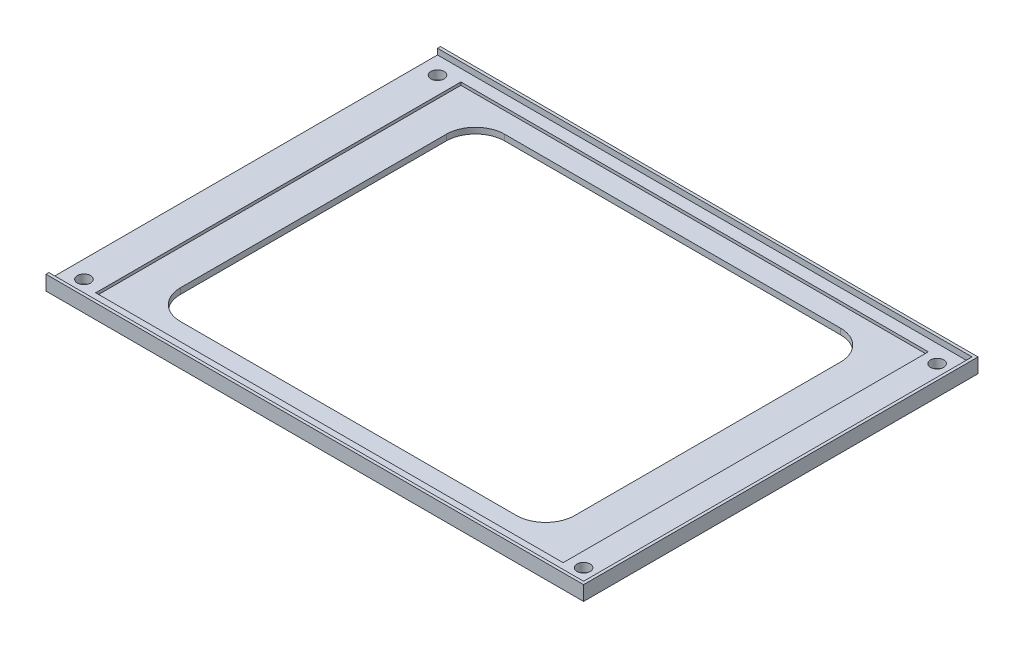
from build123d import *

# Parameters (mm, degrees)
SKETCH2_W           = 184
SKETCH2_H           = 135
BOSS_EXTRUDE1_DEPTH = 2
SKETCH3_W           = 184
SKETCH3_H           = 135
SKETCH3_W_2         = 160
SKETCH3_H_2         = 125
BOSS_EXTRUDE2_DEPTH = 1
BOSS_EXTRUDE3_DEPTH = 2
CUT_EXTRUDE1_REACH  = 170.88
SKETCH5_R           = 2.25


with BuildPart() as part:
    # Sketch2 → Boss-Extrude1 (new body)
    with BuildSketch(Plane(origin=(0, 0, 0), x_dir=(1, 0, 0), z_dir=(0, 1, 0))):
        with Locations((62.722752399, 0)):
            Rectangle(SKETCH2_W, SKETCH2_H)
        with BuildLine():
            Line((4.722752399, 55.5), (119.722752399, 55.5))
            ThreePointArc((119.722752399, 55.5), (126.79382021, 52.571067812), (129.722752399, 45.5))
            Line((129.722752399, 45.5), (129.722752399, -45.5))
            ThreePointArc((129.722752399, -45.5), (126.79382021, -52.571067812), (119.722752399, -55.5))
            Line((119.722752399, -55.5), (4.722752399, -55.5))
            ThreePointArc((4.722752399, -55.5), (-2.348315413, -52.571067812), (-5.277247601, -45.5))
            Line((-5.277247601, -45.5), (-5.277247601, 45.5))
            ThreePointArc((-5.277247601, 45.5), (-2.348315413, 52.571067812), (4.722752399, 55.5))
        make_face(mode=Mode.SUBTRACT)
    extrude(amount=BOSS_EXTRUDE1_DEPTH)

    # Sketch3 → Boss-Extrude2 (add)
    with BuildSketch(Plane(origin=(0, 2, 0), x_dir=(1, 0, 0), z_dir=(0, 1, 0))):
        with Locations((62.722752399, 0)):
            Rectangle(SKETCH3_W, SKETCH3_H)
        with Locations((62.722752399, 0)):
            Rectangle(SKETCH3_W_2, SKETCH3_H_2, mode=Mode.SUBTRACT)
    extrude(amount=BOSS_EXTRUDE2_DEPTH)

    # Sketch4 → Boss-Extrude3 (add)
    with BuildSketch(Plane(origin=(0, 3, 0), x_dir=(1, 0, 0), z_dir=(0, 1, 0))):
        Polygon((154.722752399, 67.5), (-29.277247601, 67.5), (-29.277247601, 66.5), (153.722752399, 66.5), (153.722752399, -66.5), (-29.277247601, -66.5), (-29.277247601, -67.5), (154.722752399, -67.5), align=None)
    extrude(amount=BOSS_EXTRUDE3_DEPTH)

    # Sketch5 → Cut-Extrude1 (cut, up to next)
    with BuildSketch(Plane.XZ, mode=Mode.PRIVATE) as cut_extrude1_sk1:
        with Locations(Location((-23.277247601, 60.5, 0), (0, 0, 270))):
            Circle(SKETCH5_R)
    cut_extrude1_tool1 = extrude(cut_extrude1_sk1.sketch, amount=-CUT_EXTRUDE1_REACH, mode=Mode.PRIVATE) & part.part
    # Sketch5 → Cut-Extrude1 (cut, up to next)
    with BuildSketch(Plane.XZ, mode=Mode.PRIVATE) as cut_extrude1_sk2:
        with Locations(Location((-23.277247601, -60.5, 0), (0, 0, 270))):
            Circle(SKETCH5_R)
    cut_extrude1_tool2 = extrude(cut_extrude1_sk2.sketch, amount=-CUT_EXTRUDE1_REACH, mode=Mode.PRIVATE) & part.part
    # Sketch5 → Cut-Extrude1 (cut, up to next)
    with BuildSketch(Plane.XZ, mode=Mode.PRIVATE) as cut_extrude1_sk3:
        with Locations(Location((147.722752399, -60.5, 0), (0, 0, 270))):
            Circle(SKETCH5_R)
    cut_extrude1_tool3 = extrude(cut_extrude1_sk3.sketch, amount=-CUT_EXTRUDE1_REACH, mode=Mode.PRIVATE) & part.part
    # Sketch5 → Cut-Extrude1 (cut, up to next)
    with BuildSketch(Plane.XZ, mode=Mode.PRIVATE) as cut_extrude1_sk4:
        with Locations(Location((147.722752399, 60.5, 0), (0, 0, 270))):
            Circle(SKETCH5_R)
    cut_extrude1_tool4 = extrude(cut_extrude1_sk4.sketch, amount=-CUT_EXTRUDE1_REACH, mode=Mode.PRIVATE) & part.part
    add(cut_extrude1_tool1.solids().sort_by_distance((-23.277248, 0, 60.5))[0], mode=Mode.SUBTRACT)
    add(cut_extrude1_tool2.solids().sort_by_distance((-23.277248, 0, -60.5))[0], mode=Mode.SUBTRACT)
    add(cut_extrude1_tool3.solids().sort_by_distance((147.722752, 0, -60.5))[0], mode=Mode.SUBTRACT)
    add(cut_extrude1_tool4.solids().sort_by_distance((147.722752, 0, 60.5))[0], mode=Mode.SUBTRACT)


solid = part.part
